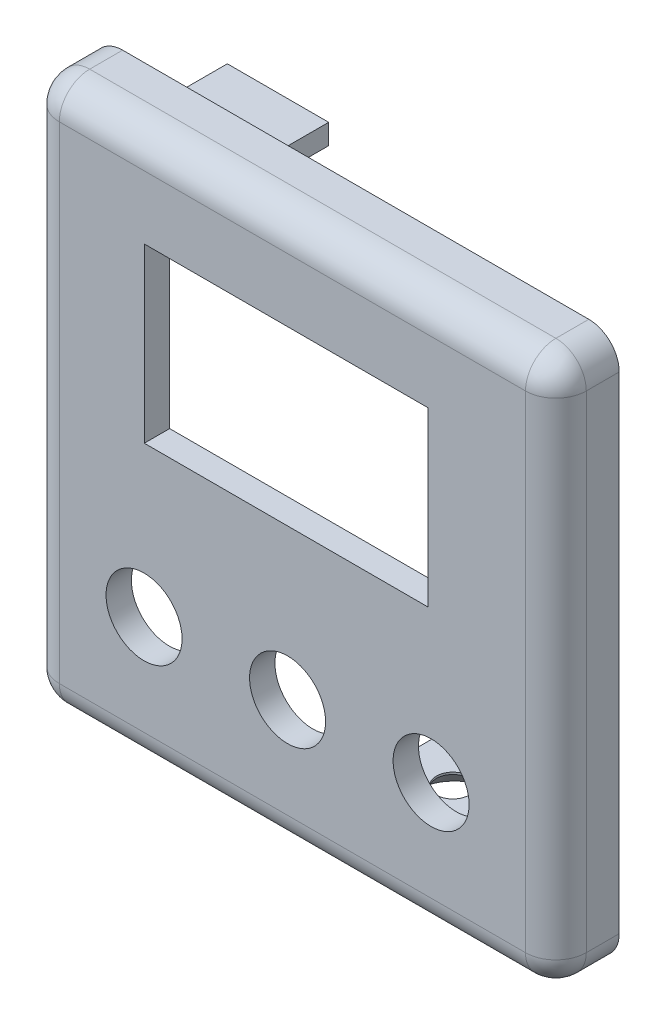
from build123d import *

# Parameters (mm, degrees)
CROQUIS1_W              = 46
CROQUIS1_H              = 46
SALIENTE_EXTRUIR1_DEPTH = 3.75
CROQUIS2_W              = 10
CROQUIS2_H              = 2
SALIENTE_EXTRUIR2_DEPTH = 8.7
CROQUIS5_W              = 10
CROQUIS5_H              = 2
SALIENTE_EXTRUIR3_DEPTH = 6
CROQUIS6_R              = 1.625
CORTAR_EXTRUIR1_DEPTH   = 2
CROQUIS7_R              = 3.35997123
CORTAR_EXTRUIR2_DEPTH   = 1.8
CORTAR_EXTRUIR2_DRAFT   = -44
CORTAR_EXTRUIR3_DEPTH   = 10
CROQUIS10_R             = 3.75
CROQUIS10_W             = 28
CROQUIS10_H             = 17.026229448
SALIENTE_EXTRUIR4_DEPTH = 2.5
REDONDEO1_R             = 3


with BuildPart() as part:
    # Croquis1 → Saliente-Extruir1 (new body)
    with BuildSketch(Plane.XY):
        with BuildLine():
            Line((-25.16229051, 26.433935563), (20.83770949, 26.433935563))
            ThreePointArc((20.83770949, 26.433935563), (22.959029834, 25.555255907), (23.83770949, 23.433935563))
            Line((23.83770949, 23.433935563), (23.83770949, -24.566064437))
            ThreePointArc((23.83770949, -24.566064437), (22.959029834, -26.687384781), (20.83770949, -27.566064437))
            Line((20.83770949, -27.566064437), (-25.16229051, -27.566064437))
            ThreePointArc((-25.16229051, -27.566064437), (-27.283610853, -26.687384781), (-28.16229051, -24.566064437))
            Line((-28.16229051, -24.566064437), (-28.16229051, 23.433935563))
            ThreePointArc((-28.16229051, 23.433935563), (-27.283610853, 25.555255907), (-25.16229051, 26.433935563))
        make_face()
        with Locations((-2.16229051, -0.566064437)):
            Rectangle(CROQUIS1_W, CROQUIS1_H, mode=Mode.SUBTRACT)
    extrude(amount=SALIENTE_EXTRUIR1_DEPTH)

    # Croquis2 → Saliente-Extruir2 (add)
    with BuildSketch(Plane(origin=(0, 0, 0), x_dir=(-1, 0, 0), z_dir=(0, 0, -1))):
        with Locations((-1.97270949, -26.566064437)):
            Rectangle(CROQUIS2_W, CROQUIS2_H)
    extrude(amount=SALIENTE_EXTRUIR2_DEPTH)

    # Croquis5 → Saliente-Extruir3 (add)
    with BuildSketch(Plane(origin=(0, 0, 0), x_dir=(-1, 0, 0), z_dir=(0, 0, -1))):
        with Locations((15.830877534, 23.433935563)):
            Rectangle(CROQUIS5_W, CROQUIS5_H)
    extrude(amount=SALIENTE_EXTRUIR3_DEPTH)

    # Croquis6 → Cortar-Extruir1 (cut)
    with BuildSketch(Plane(origin=(0, -25.566064437, 0), x_dir=(1, 0, 0), z_dir=(0, 1, 0))):
        with Locations(Location((1.97270949, 5.45, 0), (0, 0, 270))):
            Circle(CROQUIS6_R)
    extrude(amount=-CORTAR_EXTRUIR1_DEPTH, mode=Mode.SUBTRACT)


with BuildPart() as cortar_extruir2_tool:
    # Croquis7 → Cortar-Extruir2 (with draft: the straight prism first)
    with BuildSketch(Plane.XZ.offset(27.566064437)):
        with Locations((1.97270949, -5.45)):
            Circle(CROQUIS7_R)
    extrude(amount=-CORTAR_EXTRUIR2_DEPTH)
    # Cortar-Extruir2: the draft: its side faces are tilted about the plane it starts from
    cortar_extruir2_sides = [cortar_extruir2_tool.faces().sort_by_distance(p)[0] for p in [
        (-1.38726174, -26.666064437, -5.45),
    ]]
    draft(cortar_extruir2_sides, Plane.XZ.offset(27.566064437), CORTAR_EXTRUIR2_DRAFT)


with BuildPart() as part_1:
    add(part.part)

    # Cortar-Extruir2: cut by cortar_extruir2_tool
    add(cortar_extruir2_tool.part, mode=Mode.SUBTRACT)

    # Croquis9 → Cortar-Extruir3 (cut)
    with BuildSketch(Plane.ZY.offset(3.02729051)):
        with BuildLine():
            Line((-8.7, -27.375158196), (-8.7, -27.566064437))
            Line((-8.7, -27.566064437), (-7.7, -27.566064437))
            ThreePointArc((-7.7, -27.566064437), (-8.204176074, -27.492486318), (-8.7, -27.375158196))
        make_face()
    extrude(amount=-CORTAR_EXTRUIR3_DEPTH, mode=Mode.SUBTRACT)

    # Croquis10 → Saliente-Extruir4 (add)
    with BuildSketch(Plane.XY.offset(3.75)):
        with BuildLine():
            Line((-25.16229051, 26.433935563), (20.83770949, 26.433935563))
            ThreePointArc((20.83770949, 26.433935563), (22.959029834, 25.555255907), (23.83770949, 23.433935563))
            Line((23.83770949, 23.433935563), (23.83770949, -24.566064437))
            ThreePointArc((23.83770949, -24.566064437), (22.959029834, -26.687384781), (20.83770949, -27.566064437))
            Line((20.83770949, -27.566064437), (-25.16229051, -27.566064437))
            ThreePointArc((-25.16229051, -27.566064437), (-27.283610853, -26.687384781), (-28.16229051, -24.566064437))
            Line((-28.16229051, -24.566064437), (-28.16229051, 23.433935563))
            ThreePointArc((-28.16229051, 23.433935563), (-27.283610853, 25.555255907), (-25.16229051, 26.433935563))
        make_face()
        with Locations((-16.79979051, -14.691064437)):
            Circle(CROQUIS10_R, mode=Mode.SUBTRACT)
        with Locations((-2.63729051, -14.691064437)):
            Circle(CROQUIS10_R, mode=Mode.SUBTRACT)
        with Locations((11.52520949, -14.691064437)):
            Circle(CROQUIS10_R, mode=Mode.SUBTRACT)
        with Locations((-2.773558379, 8.677050287)):
            Rectangle(CROQUIS10_W, CROQUIS10_H, mode=Mode.SUBTRACT)
    extrude(amount=SALIENTE_EXTRUIR4_DEPTH)

    # Redondeo1
    redondeo1_edges = [part_1.edges().sort_by_distance(p)[0] for p in [
        (-27.283610853, 25.555255907, 6.25),
        (-28.16229051, -0.566064437, 6.25),
        (-27.283610853, -26.687384781, 6.25),
        (-2.16229051, -27.566064437, 6.25),
        (22.959029834, -26.687384781, 6.25),
        (23.83770949, -0.566064437, 6.25),
        (22.959029834, 25.555255907, 6.25),
        (-2.16229051, 26.433935563, 6.25),
    ]]
    fillet(redondeo1_edges, radius=REDONDEO1_R)


solid = part_1.part
